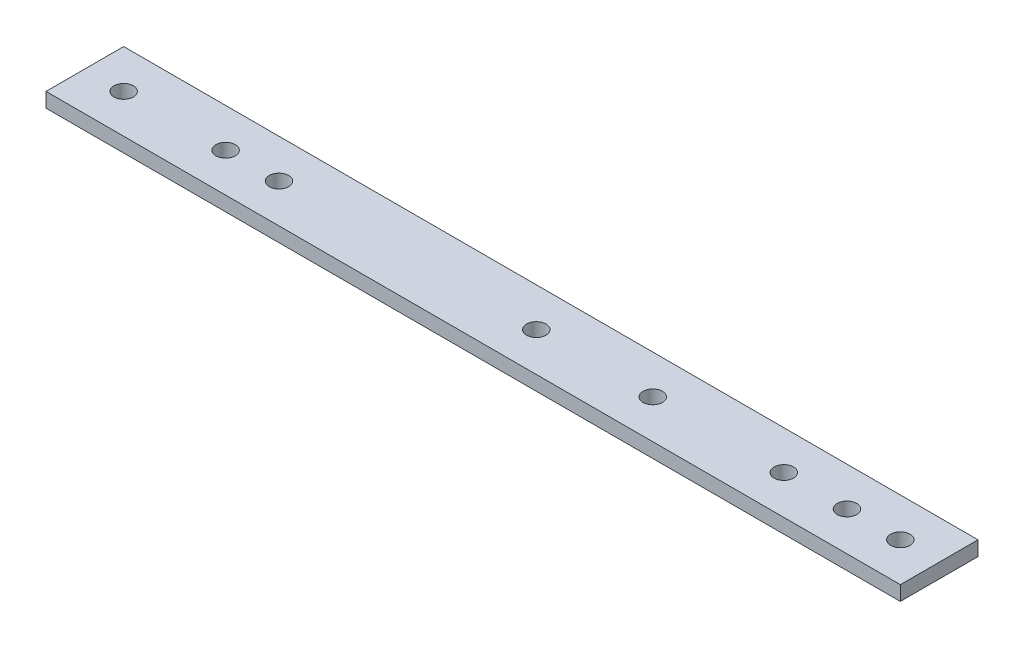
from build123d import *

# Parameters (mm, degrees)
SKETCH1_W           = 279.4
SKETCH1_H           = 25.4
BOSS_EXTRUDE1_DEPTH = 4.7625
SKETCH8_R           = 3.175
CUT_EXTRUDE6_DEPTH  = 4.7625


with BuildPart() as part:
    # Sketch1 → Boss-Extrude1 (new body)
    with BuildSketch(Plane(origin=(0, 0, 0), x_dir=(1, 0, 0), z_dir=(0, 1, 0))):
        Rectangle(SKETCH1_W, SKETCH1_H)
    extrude(amount=BOSS_EXTRUDE1_DEPTH)

    # Sketch8 → Cut-Extrude6 (cut)
    with BuildSketch(Plane(origin=(0, 4.7625, 0), x_dir=(1, 0, 0), z_dir=(0, 1, 0))):
        with Locations(Location((127, 0, 0), (0, 0, 270))):
            Circle(SKETCH8_R)
        with Locations(Location((109.5375, 0, 0), (0, 0, 270))):
            Circle(SKETCH8_R)
        with Locations(Location((88.9, 0, 0), (0, 0, 270))):
            Circle(SKETCH8_R)
        with Locations(Location((46.0375, 0, 0), (0, 0, 270))):
            Circle(SKETCH8_R)
        with Locations(Location((7.9375, 0, 0), (0, 0, 270))):
            Circle(SKETCH8_R)
        with Locations(Location((-76.2, 0, 0), (0, 0, 270))):
            Circle(SKETCH8_R)
        with Locations(Location((-127, 0, 0), (0, 0, 270))):
            Circle(SKETCH8_R)
        with Locations(Location((-93.6625, 0, 0), (0, 0, 270))):
            Circle(SKETCH8_R)
    extrude(amount=-CUT_EXTRUDE6_DEPTH, mode=Mode.SUBTRACT)


solid = part.part
